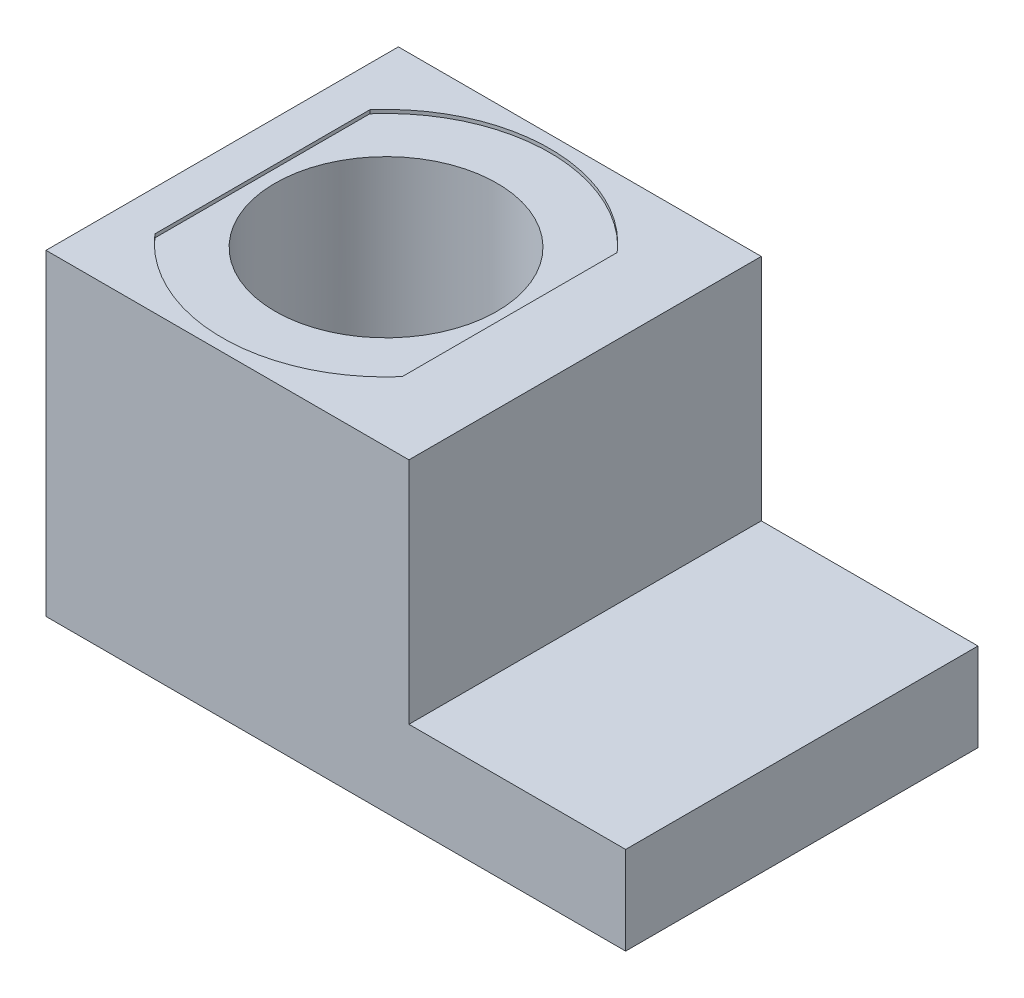
from build123d import *

# Parameters (mm, degrees)
SKETCH_1_W          = 164.5
SKETCH_1_H          = 100
EXTRUDE_1_DEPTH     = 25
SKETCH_2_W          = 103
SKETCH_2_H          = 100
EXTRUDE_2_DEPTH     = 65
CUT_EXTRUDE_3_DEPTH = 125
CUT_EXTRUDE_4_DEPTH = 1


with BuildPart() as part:
    # 草图1 → 凸台-拉伸1 (new body)
    with BuildSketch(Plane(origin=(0, 0, 0), x_dir=(1, 0, 0), z_dir=(0, 1, 0))):
        with Locations((82.25, 50)):
            Rectangle(SKETCH_1_W, SKETCH_1_H)
    extrude(amount=EXTRUDE_1_DEPTH)

    # 草图2 → 凸台-拉伸2 (add)
    with BuildSketch(Plane(origin=(0, 25, 0), x_dir=(1, 0, 0), z_dir=(0, 1, 0))):
        with Locations((51.5, 50)):
            Rectangle(SKETCH_2_W, SKETCH_2_H)
    extrude(amount=EXTRUDE_2_DEPTH)

    # 草图5 → 切除-拉伸3 (cut)
    with BuildSketch(Plane(origin=(0, 90, 0), x_dir=(1, 0, 0), z_dir=(0, 1, 0))):
        with BuildLine():
            ThreePointArc((78, 50), (46.5, 81.5), (15, 50))
            ThreePointArc((15, 50), (46.5, 18.5), (78, 50))
        make_face()
    extrude(amount=-CUT_EXTRUDE_3_DEPTH, mode=Mode.SUBTRACT)

    # 草图6 → 切除-拉伸4 (cut)
    with BuildSketch(Plane(origin=(0, 90, 0), x_dir=(1, 0, 0), z_dir=(0, 1, 0))):
        with BuildLine():
            Line((81.59399548, 19.493255152), (81.59399548, 80.506744848))
            ThreePointArc((81.59399548, 80.506744848), (46.5, 96.5), (11.40600452, 80.506744848))
            Line((11.40600452, 80.506744848), (11.40600452, 19.493255152))
            ThreePointArc((11.40600452, 19.493255152), (46.5, 3.5), (81.59399548, 19.493255152))
        make_face()
        with BuildLine():
            ThreePointArc((78, 50), (16.994826039, 38.96846749), (70.273351777, 70.665859413))
            ThreePointArc((70.273351777, 70.665859413), (76.005173961, 61.03153251), (78, 50))
        make_face(mode=Mode.SUBTRACT)
    extrude(amount=-CUT_EXTRUDE_4_DEPTH, mode=Mode.SUBTRACT)


solid = part.part
